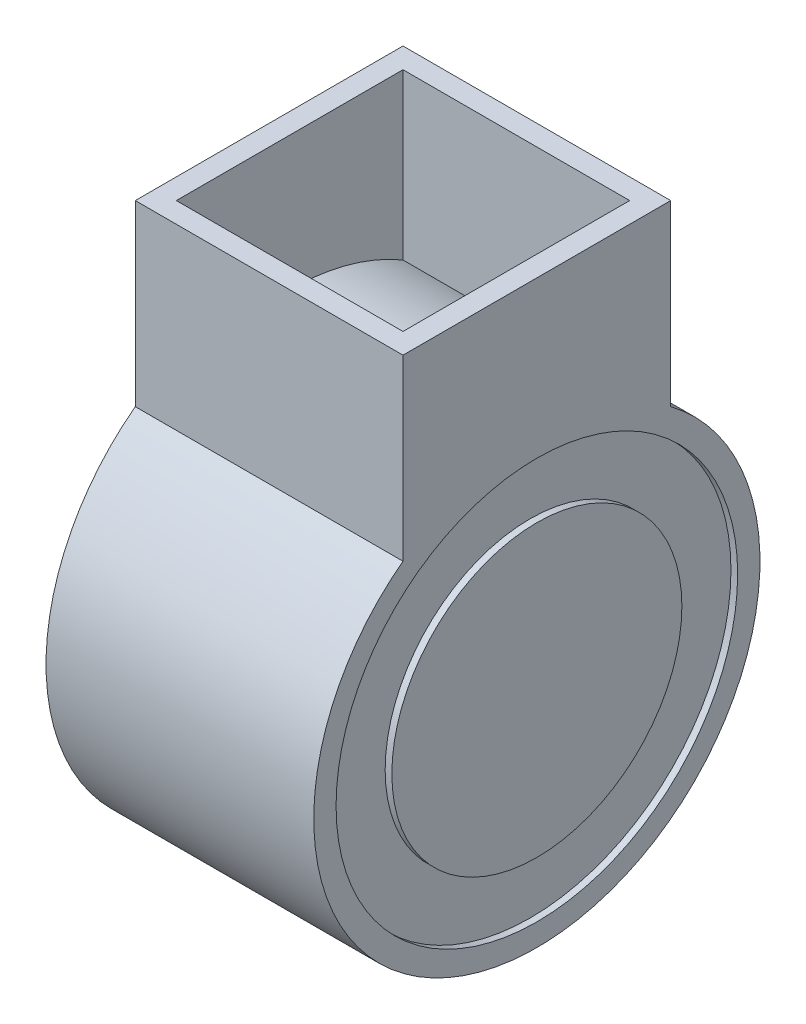
from build123d import *

# Parameters (mm, degrees)
CROQUIS1_R                   = 50
SALIENTE_EXTRUIR1_DEPTH      = 30
SALIENTE_EXTRUIR2_REACH      = 144.478
SALIENTE_EXTRUIR2_END_RADIUS = 50
CROQUIS3_W                   = 60
CROQUIS3_H                   = 60
CROQUIS3_W_2                 = 50.8
CROQUIS3_H_2                 = 50.8
CROQUIS4_R                   = 45
CROQUIS4_R_2                 = 32.5
CORTAR_EXTRUIR1_DEPTH        = 1.5


with BuildPart() as part:
    # Croquis1 → Saliente-Extruir1 (new, symmetric)
    with BuildSketch(Plane(origin=(0, 0, 0), x_dir=(0, 0, -1), z_dir=(1, 0, 0))):
        Circle(CROQUIS1_R)
    extrude(amount=SALIENTE_EXTRUIR1_DEPTH, both=True)

    # Saliente-Extruir2: up to this cylinder (the profile starts outside it)
    saliente_extruir2_end = Plane(origin=(0, 0, 0), z_dir=(-1, 0, 0)) * Cylinder(SALIENTE_EXTRUIR2_END_RADIUS, 389.956, mode=Mode.PRIVATE)
    # Croquis3 → Saliente-Extruir2 (add, up to the surface)
    with BuildSketch(Plane(origin=(0, 80, 0), x_dir=(1, 0, 0), z_dir=(0, 1, 0)), mode=Mode.PRIVATE) as saliente_extruir2_sk1:
        Rectangle(CROQUIS3_W, CROQUIS3_H)
        Rectangle(CROQUIS3_W_2, CROQUIS3_H_2, mode=Mode.SUBTRACT)
    saliente_extruir2_tool1 = extrude(saliente_extruir2_sk1.sketch, amount=-SALIENTE_EXTRUIR2_REACH, mode=Mode.PRIVATE) - saliente_extruir2_end
    add(saliente_extruir2_tool1.solids().sort_by_distance((0, 80, 29.151472))[0])

    # Croquis4 → Cortar-Extruir1 (cut)
    with BuildSketch(Plane(origin=(30, 0, 0), x_dir=(0, 0, -1), z_dir=(1, 0, 0))):
        Circle(CROQUIS4_R)
        Circle(CROQUIS4_R_2, mode=Mode.SUBTRACT)
    cortar_extruir1 = extrude(amount=-CORTAR_EXTRUIR1_DEPTH, mode=Mode.SUBTRACT)

    # Simetría1: Cortar-Extruir1 across plane
    add(cortar_extruir1.mirror(Plane(origin=(0, 0, 0), x_dir=(0, 0, 1), z_dir=(1, 0, 0))), mode=Mode.SUBTRACT)


solid = part.part
